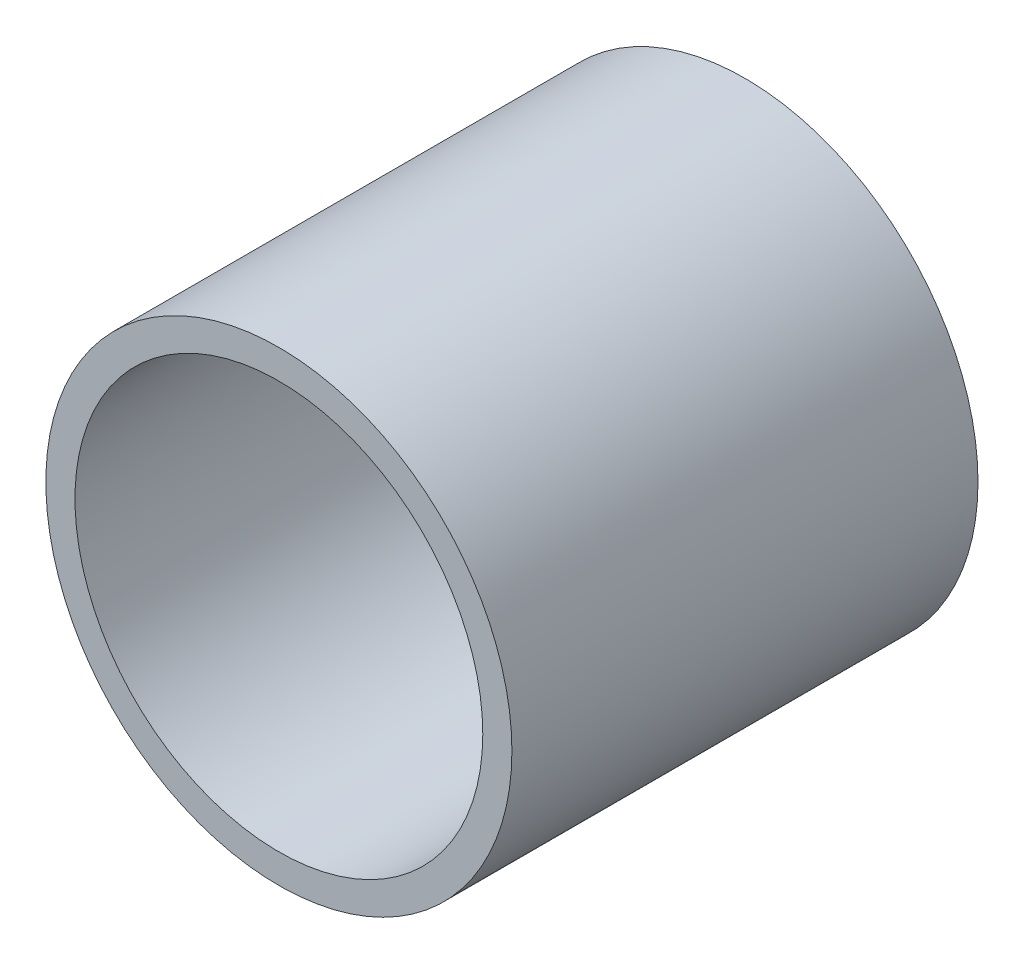
from build123d import *

# Parameters (mm, degrees)
SKETCH1_R           = 4
SKETCH1_R_2         = 3.5
BOSS_EXTRUDE1_DEPTH = 8


with BuildPart() as part:
    # Sketch1 → Boss-Extrude1 (new body)
    with BuildSketch(Plane.XY):
        Circle(SKETCH1_R)
        Circle(SKETCH1_R_2, mode=Mode.SUBTRACT)
    extrude(amount=BOSS_EXTRUDE1_DEPTH)


solid = part.part
